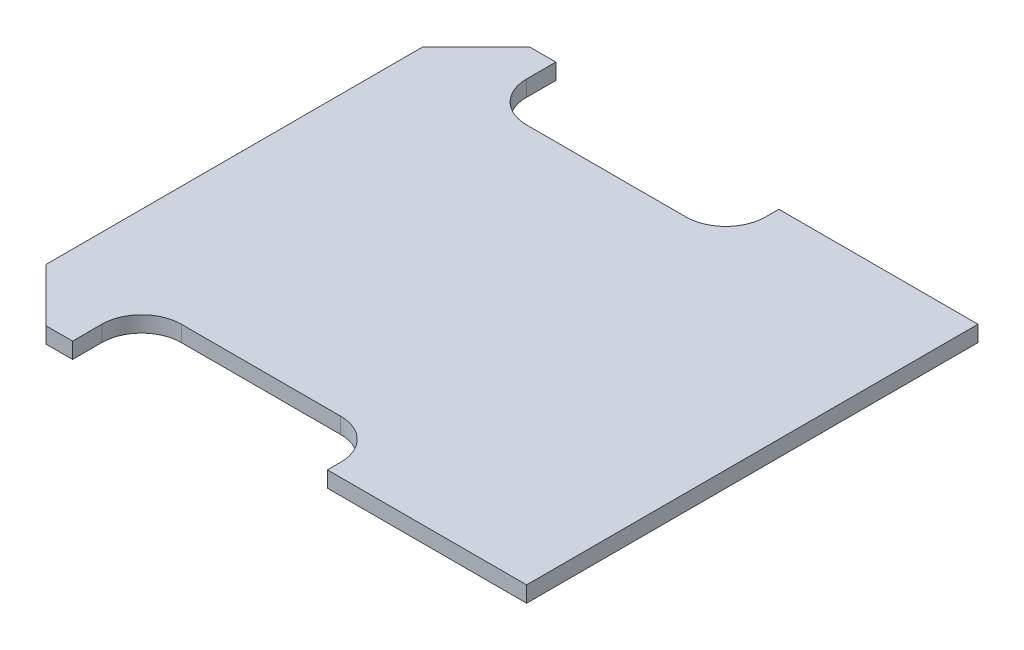
from build123d import *

# Parameters (mm, degrees)
SKETCH1_W           = 195
SKETCH1_H           = 170
BOSS_EXTRUDE1_DEPTH = 6
SKETCH2_W           = 90
SKETCH2_H           = 20
CUT_EXTRUDE1_DEPTH  = 130.48841647
FILLET1_R           = 15
SKETCH3_W           = 30
SKETCH3_H           = 6
BOSS_EXTRUDE2_DEPTH = 6
CHAMFER1_SIZE       = 20
SKETCH4_R           = 4
CUT_EXTRUDE2_DEPTH  = 4.2
SKETCH5_W           = 12.3
SKETCH5_H           = 12.3
CUT_EXTRUDE3_DEPTH  = 4.2
SKETCH6_W           = 12.3
SKETCH6_H           = 15.15
CUT_EXTRUDE4_DEPTH  = 3.2


with BuildPart() as part:
    # Sketch1 → Boss-Extrude1 (new body)
    with BuildSketch(Plane(origin=(0, 0, 0), x_dir=(1, 0, 0), z_dir=(0, 1, 0))):
        Rectangle(SKETCH1_W, SKETCH1_H)
    extrude(amount=BOSS_EXTRUDE1_DEPTH)

    # Sketch2 → Cut-Extrude1 (cut, through all)
    with BuildSketch(Plane(origin=(0, 6, 0), x_dir=(1, 0, 0), z_dir=(0, 1, 0))):
        with Locations((-22.5, -75)):
            Rectangle(SKETCH2_W, SKETCH2_H)
        with Locations((-22.5, 75)):
            Rectangle(SKETCH2_W, SKETCH2_H)
    extrude(amount=-CUT_EXTRUDE1_DEPTH, mode=Mode.SUBTRACT)

    # Fillet1
    fillet1_edges = [part.edges().sort_by_distance(p)[0] for p in [
        (-67.5, 3, 65),
        (22.5, 3, 65),
        (-67.5, 3, -65),
        (22.5, 3, -65),
    ]]
    fillet(fillet1_edges, radius=FILLET1_R)

    # Sketch3 → Boss-Extrude2 (add)
    with BuildSketch(Plane(origin=(0, 6, 0), x_dir=(1, 0, 0), z_dir=(0, 1, 0))):
        with Locations((-82.5, 88)):
            Rectangle(SKETCH3_W, SKETCH3_H)
        with Locations((-82.5, -88)):
            Rectangle(SKETCH3_W, SKETCH3_H)
    extrude(amount=-BOSS_EXTRUDE2_DEPTH)

    # Chamfer1
    chamfer1_edges = [part.edges().sort_by_distance(p)[0] for p in [
        (-97.5, 3, -91),
        (-97.5, 3, 91),
    ]]
    chamfer(chamfer1_edges, length=CHAMFER1_SIZE)

    # Sketch4 → Cut-Extrude2 (cut)
    with BuildSketch(Plane.XZ):
        with Locations(Location((82.166666667, -75, 0), (0, 0, 270))):
            Circle(SKETCH4_R)
        with Locations(Location((82.166666667, 75, 0), (0, 0, 90))):
            Circle(SKETCH4_R)
    extrude(amount=-CUT_EXTRUDE2_DEPTH, mode=Mode.SUBTRACT)

    # Sketch5 → Cut-Extrude3 (cut)
    with BuildSketch(Plane.XZ):
        with Locations((82.166666667, 59.85)):
            Rectangle(SKETCH5_W, SKETCH5_H)
        with Locations((82.166666667, -59.85)):
            Rectangle(SKETCH5_W, SKETCH5_H)
    extrude(amount=-CUT_EXTRUDE3_DEPTH, mode=Mode.SUBTRACT)

    # Sketch6 → Cut-Extrude4 (cut)
    with BuildSketch(Plane.XZ.offset(-4.2)):
        with Locations((82.166666667, -73.575)):
            Rectangle(SKETCH6_W, SKETCH6_H)
        with Locations((82.166666667, 73.575)):
            Rectangle(SKETCH6_W, SKETCH6_H)
    extrude(amount=CUT_EXTRUDE4_DEPTH, mode=Mode.SUBTRACT)


solid = part.part
